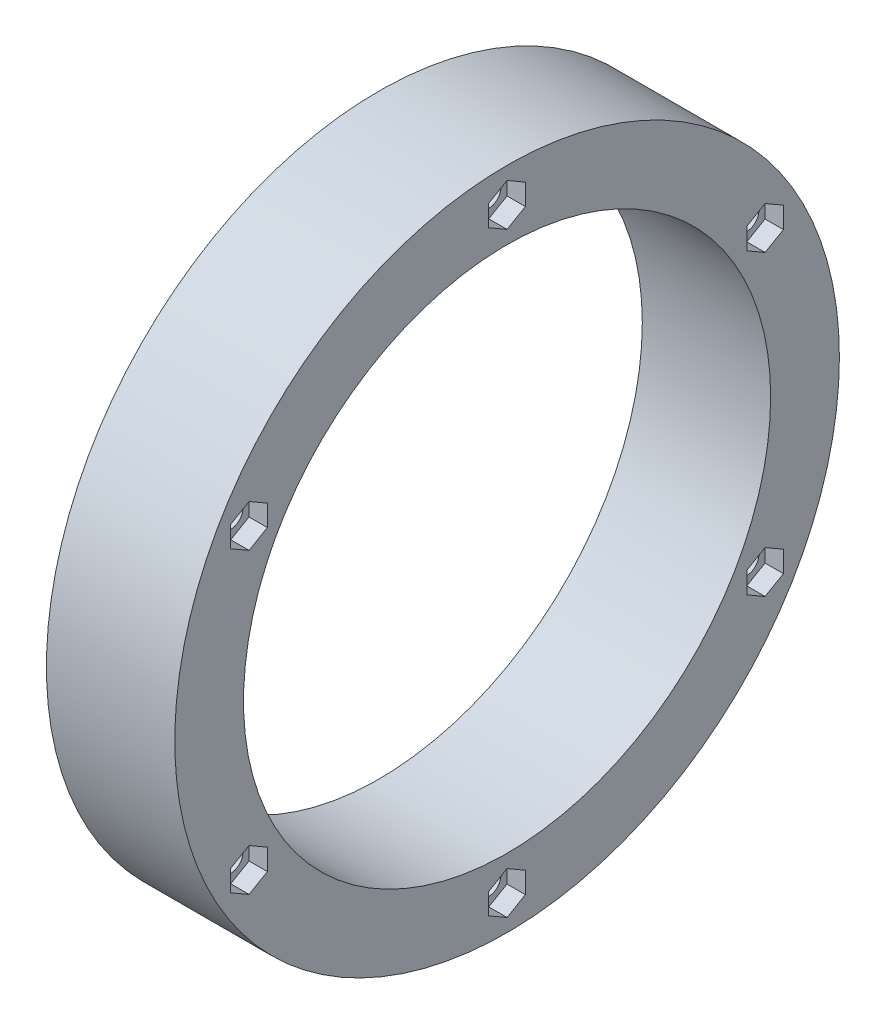
from build123d import *

# Parameters (mm, degrees)
SKETCH1_R           = 72.5
SKETCH1_R_2         = 57.5
BOSS_EXTRUDE1_DEPTH = 28
CUT_EXTRUDE1_DEPTH  = 4
CUT_EXTRUDE2_REACH  = 108.285
SKETCH3_R           = 2.65


with BuildPart() as part:
    # Sketch1 → Boss-Extrude1 (new body)
    with BuildSketch(Plane(origin=(0, 0, 0), x_dir=(0, 0, -1), z_dir=(1, 0, 0))):
        Circle(SKETCH1_R)
        Circle(SKETCH1_R_2, mode=Mode.SUBTRACT)
    extrude(amount=BOSS_EXTRUDE1_DEPTH)

    # Sketch2 → Cut-Extrude1 (cut)
    with BuildSketch(Plane(origin=(28, 0, 0), x_dir=(0, 0, -1), z_dir=(1, 0, 0))):
        Polygon((52.291651246, 30.190598923), (56.291651246, 27.881197846), (60.291651246, 30.190598923), (60.291651246, 34.809401077), (56.291651246, 37.118802154), (52.291651246, 34.809401077), align=None)
        Polygon((0, 60.381197846), (4, 62.690598923), (4, 67.309401077), (0, 69.618802154), (-4, 67.309401077), (-4, 62.690598923), align=None)
        Polygon((52.291651246, -30.190598923), (52.291651246, -34.809401077), (56.291651246, -37.118802154), (60.291651246, -34.809401077), (60.291651246, -30.190598923), (56.291651246, -27.881197846), align=None)
        Polygon((0, -60.381197846), (-4, -62.690598923), (-4, -67.309401077), (0, -69.618802154), (4, -67.309401077), (4, -62.690598923), align=None)
        Polygon((-52.291651246, -30.190598923), (-56.291651246, -27.881197846), (-60.291651246, -30.190598923), (-60.291651246, -34.809401077), (-56.291651246, -37.118802154), (-52.291651246, -34.809401077), align=None)
        Polygon((-52.291651246, 30.190598923), (-52.291651246, 34.809401077), (-56.291651246, 37.118802154), (-60.291651246, 34.809401077), (-60.291651246, 30.190598923), (-56.291651246, 27.881197846), align=None)
    extrude(amount=-CUT_EXTRUDE1_DEPTH, mode=Mode.SUBTRACT)

    # Sketch3 → Cut-Extrude2 (cut, up to next)
    with BuildSketch(Plane(origin=(28, 0, 0), x_dir=(0, 0, -1), z_dir=(1, 0, 0)), mode=Mode.PRIVATE) as cut_extrude2_sk1:
        with Locations((0, 65)):
            Circle(SKETCH3_R)
    cut_extrude2_tool1 = extrude(cut_extrude2_sk1.sketch, amount=-CUT_EXTRUDE2_REACH, mode=Mode.PRIVATE) & part.part
    # Sketch3 → Cut-Extrude2 (cut, up to next)
    with BuildSketch(Plane(origin=(28, 0, 0), x_dir=(0, 0, -1), z_dir=(1, 0, 0)), mode=Mode.PRIVATE) as cut_extrude2_sk2:
        with Locations((56.291651246, 32.5)):
            Circle(SKETCH3_R)
    cut_extrude2_tool2 = extrude(cut_extrude2_sk2.sketch, amount=-CUT_EXTRUDE2_REACH, mode=Mode.PRIVATE) & part.part
    # Sketch3 → Cut-Extrude2 (cut, up to next)
    with BuildSketch(Plane(origin=(28, 0, 0), x_dir=(0, 0, -1), z_dir=(1, 0, 0)), mode=Mode.PRIVATE) as cut_extrude2_sk3:
        with Locations((56.291651246, -32.5)):
            Circle(SKETCH3_R)
    cut_extrude2_tool3 = extrude(cut_extrude2_sk3.sketch, amount=-CUT_EXTRUDE2_REACH, mode=Mode.PRIVATE) & part.part
    # Sketch3 → Cut-Extrude2 (cut, up to next)
    with BuildSketch(Plane(origin=(28, 0, 0), x_dir=(0, 0, -1), z_dir=(1, 0, 0)), mode=Mode.PRIVATE) as cut_extrude2_sk4:
        with Locations((0, -65)):
            Circle(SKETCH3_R)
    cut_extrude2_tool4 = extrude(cut_extrude2_sk4.sketch, amount=-CUT_EXTRUDE2_REACH, mode=Mode.PRIVATE) & part.part
    # Sketch3 → Cut-Extrude2 (cut, up to next)
    with BuildSketch(Plane(origin=(28, 0, 0), x_dir=(0, 0, -1), z_dir=(1, 0, 0)), mode=Mode.PRIVATE) as cut_extrude2_sk5:
        with Locations((-56.291651246, -32.5)):
            Circle(SKETCH3_R)
    cut_extrude2_tool5 = extrude(cut_extrude2_sk5.sketch, amount=-CUT_EXTRUDE2_REACH, mode=Mode.PRIVATE) & part.part
    # Sketch3 → Cut-Extrude2 (cut, up to next)
    with BuildSketch(Plane(origin=(28, 0, 0), x_dir=(0, 0, -1), z_dir=(1, 0, 0)), mode=Mode.PRIVATE) as cut_extrude2_sk6:
        with Locations((-56.291651246, 32.5)):
            Circle(SKETCH3_R)
    cut_extrude2_tool6 = extrude(cut_extrude2_sk6.sketch, amount=-CUT_EXTRUDE2_REACH, mode=Mode.PRIVATE) & part.part
    add(cut_extrude2_tool1.solids().sort_by_distance((28, 65, 0))[0], mode=Mode.SUBTRACT)
    add(cut_extrude2_tool2.solids().sort_by_distance((28, 32.5, -56.291651))[0], mode=Mode.SUBTRACT)
    add(cut_extrude2_tool3.solids().sort_by_distance((28, -32.5, -56.291651))[0], mode=Mode.SUBTRACT)
    add(cut_extrude2_tool4.solids().sort_by_distance((28, -65, 0))[0], mode=Mode.SUBTRACT)
    add(cut_extrude2_tool5.solids().sort_by_distance((28, -32.5, 56.291651))[0], mode=Mode.SUBTRACT)
    add(cut_extrude2_tool6.solids().sort_by_distance((28, 32.5, 56.291651))[0], mode=Mode.SUBTRACT)


solid = part.part
